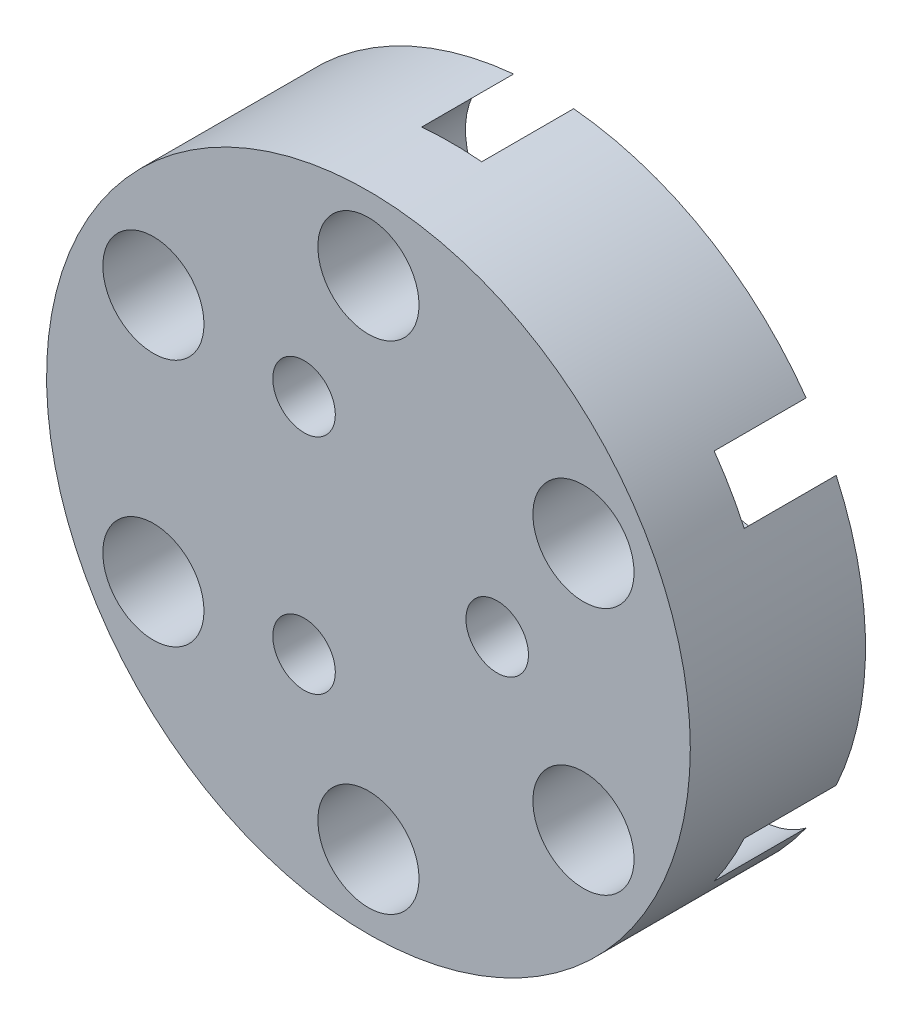
from build123d import *

# Parameters (mm, degrees)
SKETCH1_R           = 17.5
BOSS_EXTRUDE1_DEPTH = 9.525
SKETCH2_R           = 2.75
M5_THROUGH_DEPTH    = 9.525
SKETCH3_R           = 1.7
M4_DRILL_DEPTH      = 9.525
SKETCH4_R           = 4.25
CUT_EXTRUDE2_DEPTH  = 5


with BuildPart() as part:
    # Sketch1 → Boss-Extrude1 (new body)
    with BuildSketch(Plane.XY):
        with Locations(Location((0, 0, 0), (0, 0, 180))):
            Circle(SKETCH1_R)
    extrude(amount=BOSS_EXTRUDE1_DEPTH)

    # Sketch2 → M5_through (cut)
    with BuildSketch(Plane.XY.offset(9.525)):
        with Locations((0, 13.5)):
            Circle(SKETCH2_R)
        with Locations((11.691342951, 6.75)):
            Circle(SKETCH2_R)
        with Locations((11.691342951, -6.75)):
            Circle(SKETCH2_R)
        with Locations((0, -13.5)):
            Circle(SKETCH2_R)
        with Locations((-11.691342951, -6.75)):
            Circle(SKETCH2_R)
        with Locations((-11.691342951, 6.75)):
            Circle(SKETCH2_R)
    extrude(amount=-M5_THROUGH_DEPTH, mode=Mode.SUBTRACT)

    # Sketch3 → M4_DRILL (cut)
    with BuildSketch(Plane.XY.offset(9.525)):
        with Locations((-3.5, 6.062177826)):
            Circle(SKETCH3_R)
        with Locations((7, 0)):
            Circle(SKETCH3_R)
        with Locations((-3.5, -6.062177826)):
            Circle(SKETCH3_R)
    extrude(amount=-M4_DRILL_DEPTH, mode=Mode.SUBTRACT)

    # Sketch4 → Cut-Extrude2 (cut)
    with BuildSketch(Plane(origin=(0, 0, 0), x_dir=(-1, 0, 0), z_dir=(0, 0, -1))):
        with Locations((0, 13.5)):
            Circle(SKETCH4_R)
        with Locations((11.691342951, 6.75)):
            Circle(SKETCH4_R)
        with Locations((11.691342951, -6.75)):
            Circle(SKETCH4_R)
        with Locations((0, -13.5)):
            Circle(SKETCH4_R)
        with Locations((-11.691342951, -6.75)):
            Circle(SKETCH4_R)
        with Locations((-11.691342951, 6.75)):
            Circle(SKETCH4_R)
    extrude(amount=-CUT_EXTRUDE2_DEPTH, mode=Mode.SUBTRACT)


solid = part.part
